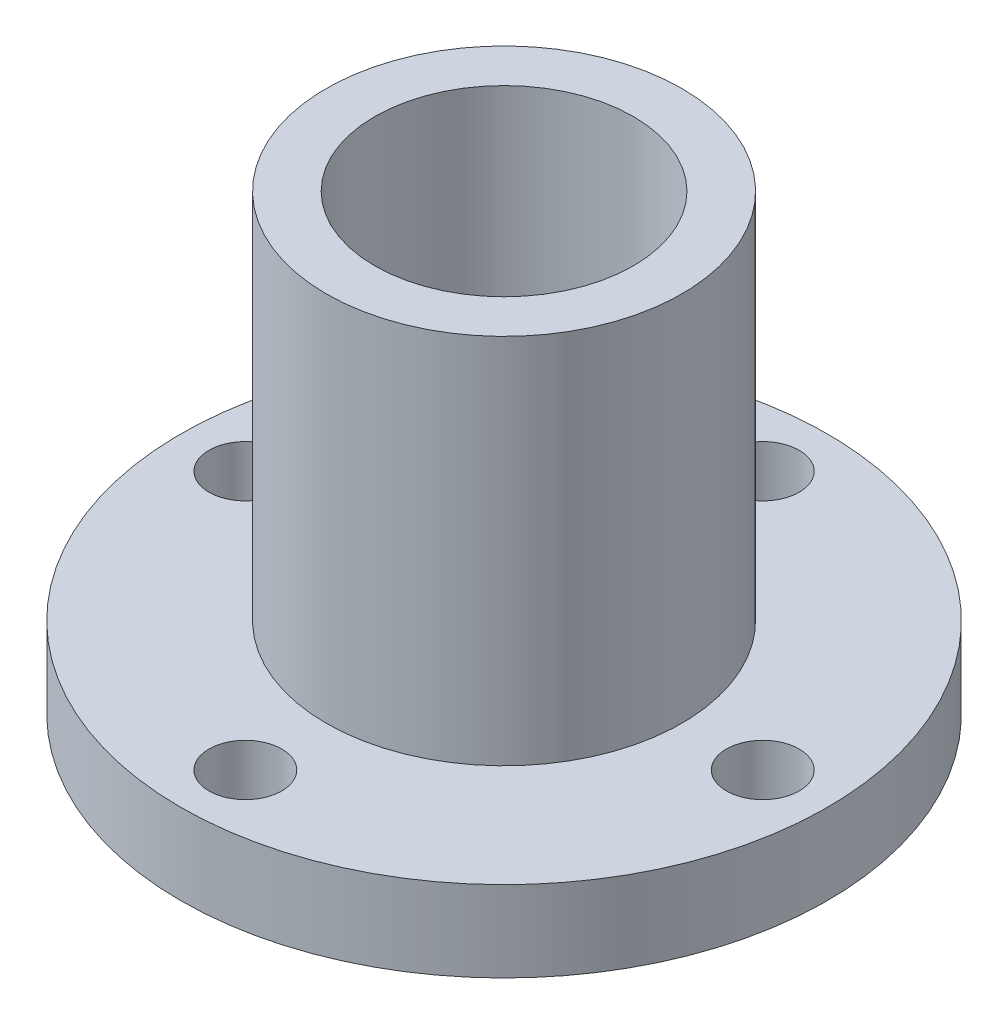
from build123d import *

# Parameters (mm, degrees)
SKETCH_1_R          = 20
EXTRUDE_1_DEPTH     = 28
SKETCH_2_OUTSIDE_W  = 54.624
SKETCH_2_OUTSIDE_H  = 54.624
SKETCH_2_OUTSIDE_R  = 11
CUT_EXTRUDE_1_DEPTH = 23
SKETCH_3_R          = 8
CUT_EXTRUDE_2_DEPTH = 28
SKETCH_4_R          = 2.25
CUT_EXTRUDE_3_DEPTH = 5


with BuildPart() as part:
    # 草图1 → 凸台-拉伸1 (new body)
    with BuildSketch(Plane(origin=(0, 0, 0), x_dir=(1, 0, 0), z_dir=(0, 1, 0))):
        with Locations(Location((0, 0, 0), (0, 0, 270))):
            Circle(SKETCH_1_R)
    extrude(amount=EXTRUDE_1_DEPTH)

    # 草图2 outside → 切除-拉伸1 (cut)
    with BuildSketch(Plane(origin=(0, 28, 0), x_dir=(1, 0, 0), z_dir=(0, 1, 0))):
        Rectangle(SKETCH_2_OUTSIDE_W, SKETCH_2_OUTSIDE_H)
        with Locations(Location((0, 0, 0), (0, 0, 270))):
            Circle(SKETCH_2_OUTSIDE_R, mode=Mode.SUBTRACT)
    extrude(amount=-CUT_EXTRUDE_1_DEPTH, mode=Mode.SUBTRACT)

    # 草图3 → 切除-拉伸2 (cut)
    with BuildSketch(Plane(origin=(0, 28, 0), x_dir=(1, 0, 0), z_dir=(0, 1, 0))):
        with Locations(Location((0, 0, 0), (0, 0, 270))):
            Circle(SKETCH_3_R)
    extrude(amount=-CUT_EXTRUDE_2_DEPTH, mode=Mode.SUBTRACT)

    # 草图4 → 切除-拉伸3 (cut)
    with BuildSketch(Plane.XZ):
        with Locations(Location((0, 16, 0), (0, 0, 270))):
            Circle(SKETCH_4_R)
        with Locations(Location((16, 0, 0), (0, 0, 270))):
            Circle(SKETCH_4_R)
        with Locations(Location((0, -16, 0), (0, 0, 90))):
            Circle(SKETCH_4_R)
        with Locations(Location((-16, 0, 0), (0, 0, 90))):
            Circle(SKETCH_4_R)
    extrude(amount=-CUT_EXTRUDE_3_DEPTH, mode=Mode.SUBTRACT)


solid = part.part
